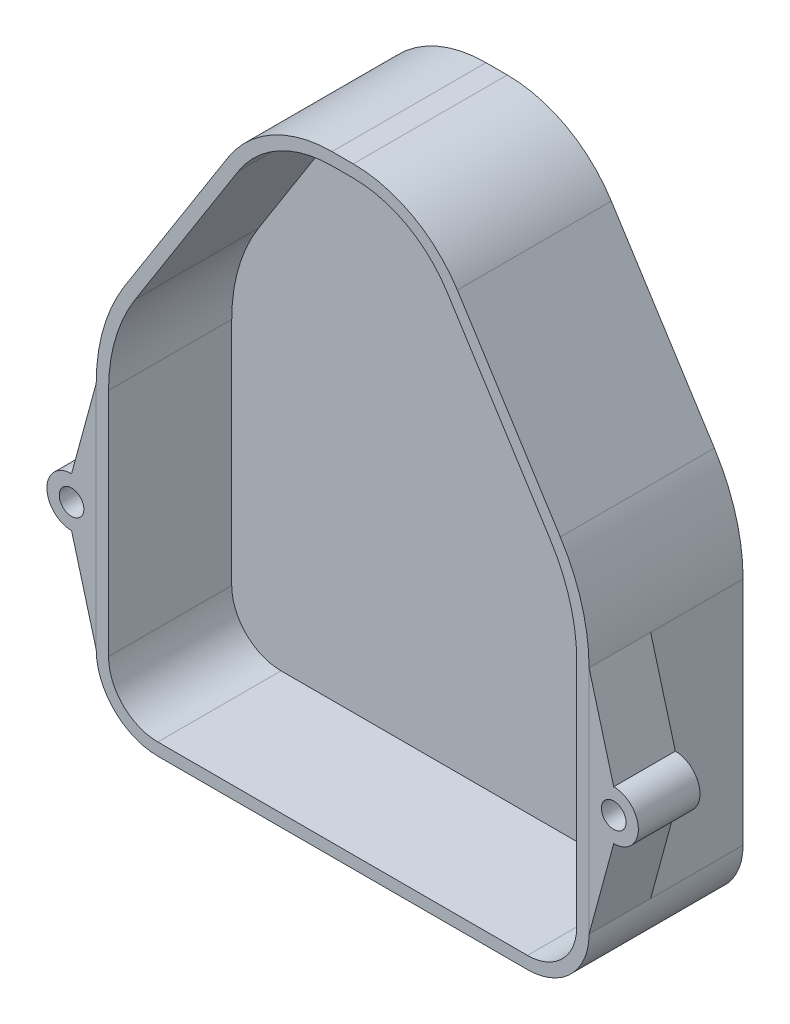
from build123d import *

# Parameters (mm, degrees)
BOSS_EXTRUDE4_DEPTH   = 25
SKETCH4_R             = 2
BOSS_EXTRUDE5_DEPTH   = 10
BOSS_EXTRUDE5_2_DEPTH = 10
BOSS_EXTRUDE7_DEPTH   = 5


with BuildPart() as part:
    # Sketch2 → Boss-Extrude4 (new body)
    with BuildSketch(Plane.XY):
        with BuildLine():
            Line((-40, -37), (-40, 0.410620311))
            ThreePointArc((-40, 0.410620311), (-38.809792049, 8.77697448), (-35.333607862, 16.479481898))
            Line((-35.333607862, 16.479481898), (-18.616441267, 42.83518487))
            ThreePointArc((-18.616441267, 42.83518487), (-11.364498397, 49.647613871), (-1.727369359, 52.122610479))
            Line((-1.727369359, 52.122610479), (0, 52.122610479))
            Line((0, 52.122610479), (1.727369359, 52.122610479))
            ThreePointArc((1.727369359, 52.122610479), (11.364498397, 49.647613871), (18.616441267, 42.83518487))
            Line((18.616441267, 42.83518487), (35.333607862, 16.479481898))
            ThreePointArc((35.333607862, 16.479481898), (38.809792049, 8.77697448), (40, 0.410620311))
            Line((40, 0.410620311), (40, -37))
            ThreePointArc((40, -37), (37.071067812, -44.071067812), (30, -47))
            Line((30, -47), (0, -47))
            Line((0, -47), (-30, -47))
            ThreePointArc((-30, -47), (-37.071067812, -44.071067812), (-40, -37))
        make_face()
        with BuildLine():
            Line((0, 50.122610479), (-1.727369359, 50.122610479))
            ThreePointArc((-1.727369359, 50.122610479), (-10.400785493, 47.895113532), (-16.927534076, 41.763927431))
            Line((-16.927534076, 41.763927431), (-33.644700671, 15.408224459))
            ThreePointArc((-33.644700671, 15.408224459), (-36.889139246, 8.219217535), (-38, 0.410620311))
            Line((-38, 0.410620311), (-38, -37))
            ThreePointArc((-38, -37), (-35.656854249, -42.656854249), (-30, -45))
            Line((-30, -45), (0, -45))
            Line((0, -45), (30, -45))
            ThreePointArc((30, -45), (35.656854249, -42.656854249), (38, -37))
            Line((38, -37), (38, 0.410620311))
            ThreePointArc((38, 0.410620311), (36.889139246, 8.219217535), (33.644700671, 15.408224459))
            Line((33.644700671, 15.408224459), (16.927534076, 41.763927431))
            ThreePointArc((16.927534076, 41.763927431), (10.400785493, 47.895113532), (1.727369359, 50.122610479))
            Line((1.727369359, 50.122610479), (0, 50.122610479))
        make_face(mode=Mode.SUBTRACT)
    extrude(amount=BOSS_EXTRUDE4_DEPTH)

    # Sketch6 → Boss-Extrude7 (add)
    with BuildSketch(Plane(origin=(0, 0, 0), x_dir=(-1, 0, 0), z_dir=(0, 0, -1))):
        with BuildLine():
            Line((1.727369359, 52.122610479), (-1.727369359, 52.122610479))
            ThreePointArc((-1.727369359, 52.122610479), (-11.364498397, 49.647613871), (-18.616441267, 42.83518487))
            Line((-18.616441267, 42.83518487), (-35.333607862, 16.479481898))
            ThreePointArc((-35.333607862, 16.479481898), (-38.809792049, 8.77697448), (-40, 0.410620311))
            Line((-40, 0.410620311), (-40, -37))
            ThreePointArc((-40, -37), (-37.071067812, -44.071067812), (-30, -47))
            Line((-30, -47), (30, -47))
            ThreePointArc((30, -47), (37.071067812, -44.071067812), (40, -37))
            Line((40, -37), (40, 0.410620311))
            ThreePointArc((40, 0.410620311), (38.809792049, 8.77697448), (35.333607862, 16.479481898))
            Line((35.333607862, 16.479481898), (18.616441267, 42.83518487))
            ThreePointArc((18.616441267, 42.83518487), (11.364498397, 49.647613871), (1.727369359, 52.122610479))
        make_face()
    extrude(amount=-BOSS_EXTRUDE7_DEPTH)


with BuildPart() as body_2:
    # Sketch4 → Boss-Extrude5 (new body)
    with BuildSketch(Plane.XY.offset(25)):
        with BuildLine():
            Line((40, 0.410620311), (44, -14.294689844))
            ThreePointArc((44, -14.294689844), (48, -18.294689844), (44, -22.294689844))
            Line((44, -22.294689844), (40, -37))
            Line((40, -37), (40, 0.410620311))
        make_face()
        with Locations((44, -18.294689844)):
            Circle(SKETCH4_R, mode=Mode.SUBTRACT)
    extrude(amount=-BOSS_EXTRUDE5_DEPTH)


with BuildPart() as body_3:
    # Sketch4 → Boss-Extrude5 2 (new body)
    with BuildSketch(Plane.XY.offset(25)):
        with BuildLine():
            Line((-40, 0.410620311), (-44, -14.294689844))
            ThreePointArc((-44, -14.294689844), (-48, -18.294689844), (-44, -22.294689844))
            Line((-44, -22.294689844), (-40, -37))
            Line((-40, -37), (-40, 0.410620311))
        make_face()
        with Locations((-44, -18.294689844)):
            Circle(SKETCH4_R, mode=Mode.SUBTRACT)
    extrude(amount=-BOSS_EXTRUDE5_2_DEPTH)


solid = Compound([part.part, body_2.part, body_3.part])
